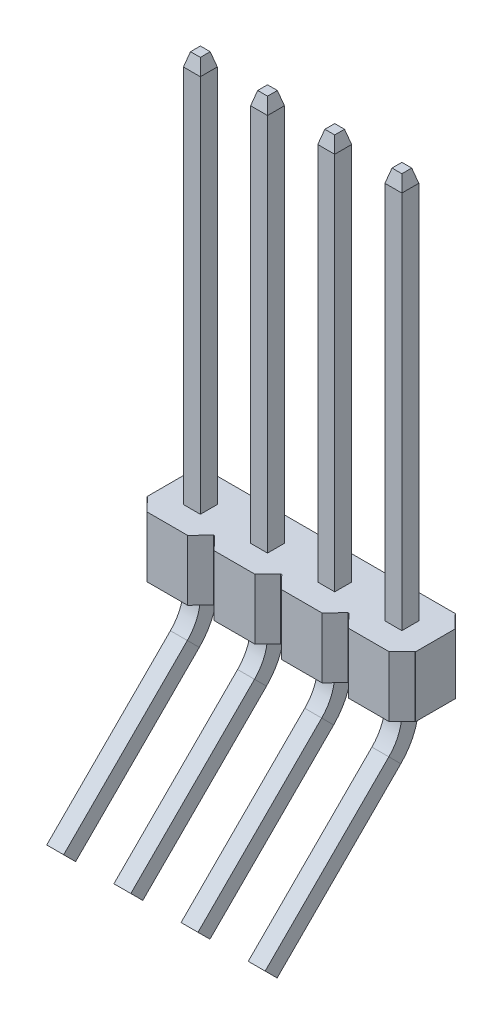
from build123d import *
from OCP.BRepFilletAPI import BRepFilletAPI_MakeChamfer

# Parameters (mm, degrees)
BOSS_EXTRUDE1_DEPTH         = 2.29
SKETCH3_W                   = 0.64
SKETCH3_H                   = 0.64
CHAMFER3_SIZE               = 0.5
CHAMFER3_SIZE2              = 0.133974596
LPATTERN1_COUNT             = 4
LPATTERN1_PITCH             = 2.54
CHAMFER3_OF_LPATTERN1_SIZE  = 0.5
CHAMFER3_OF_LPATTERN1_SIZE2 = 0.133974596


with BuildPart() as part:
    # Sketch1 → Boss-Extrude1 (new body)
    with BuildSketch(Plane(origin=(0, 0, 0), x_dir=(1, 0, 0), z_dir=(0, 1, 0))):
        Polygon((-0.77, 1.25), (0.77, 1.25), (1.25, 0.75), (1.27, 0.75), (1.27, -0.75), (1.25, -0.75), (0.77, -1.25), (-0.77, -1.25), (-1.25, -0.75), (-1.27, -0.75), (-1.27, 0.75), (-1.25, 0.75), align=None)
    boss_extrude1 = extrude(amount=BOSS_EXTRUDE1_DEPTH)

    # Sweep1: sweep along a path in Sketch2
    with BuildLine(Plane(origin=(0, 0, 0), x_dir=(0, 0, -1), z_dir=(1, 0, 0))) as sweep1_path:
        Line((0, 17.12), (0, -0.408142235))
        ThreePointArc((0, -0.408142235), (-0.152240935, -1.1735091), (-0.585786438, -1.822355798))
        Line((-0.585786438, -1.822355798), (-5.26343064, -6.5))
    # Sketch3 → Sweep1 (sweep)
    with BuildSketch(Plane(origin=(0, 17.12, 0), x_dir=(1, 0, 0), z_dir=(0, 1, 0))):
        Rectangle(SKETCH3_W, SKETCH3_H)
    sweep1 = sweep(path=sweep1_path.line)

    # Chamfer3: one chamfer whose edges measure the first distance from different faces: ONE call of the kernel's chamfer builder (chamfer() names one face for all edges)
    chamfer3_edges_1 = [part.edges().sort_by_distance(p)[0] for p in [
        (0.32, 17.12, 0),
    ]]
    chamfer3_side_1 = [part.faces().sort_by_distance(p)[0] for p in [
        (0.32, 9.705, 0),
    ]]
    chamfer3_edges_2 = [part.edges().sort_by_distance(p)[0] for p in [
        (0, 17.12, -0.32),
    ]]
    chamfer3_side_2 = [part.faces().sort_by_distance(p)[0] for p in [
        (0, 9.705, -0.32),
    ]]
    chamfer3_edges_3 = [part.edges().sort_by_distance(p)[0] for p in [
        (-0.32, 17.12, 0),
    ]]
    chamfer3_side_3 = [part.faces().sort_by_distance(p)[0] for p in [
        (-0.32, 9.705, 0),
    ]]
    chamfer3_edges_4 = [part.edges().sort_by_distance(p)[0] for p in [
        (0, 17.12, 0.32),
    ]]
    chamfer3_side_4 = [part.faces().sort_by_distance(p)[0] for p in [
        (0, 9.705, 0.32),
    ]]
    chamfer3 = BRepFilletAPI_MakeChamfer(part.part.solid().wrapped)
    for e in chamfer3_edges_1:
        chamfer3.Add(CHAMFER3_SIZE, CHAMFER3_SIZE2, e.wrapped, chamfer3_side_1[0].wrapped)  # the first distance lies on this face
    for e in chamfer3_edges_2:
        chamfer3.Add(CHAMFER3_SIZE, CHAMFER3_SIZE2, e.wrapped, chamfer3_side_2[0].wrapped)  # the first distance lies on this face
    for e in chamfer3_edges_3:
        chamfer3.Add(CHAMFER3_SIZE, CHAMFER3_SIZE2, e.wrapped, chamfer3_side_3[0].wrapped)  # the first distance lies on this face
    for e in chamfer3_edges_4:
        chamfer3.Add(CHAMFER3_SIZE, CHAMFER3_SIZE2, e.wrapped, chamfer3_side_4[0].wrapped)  # the first distance lies on this face
    add(Compound.cast(chamfer3.Shape()), mode=Mode.REPLACE)

    # LPattern1: Boss-Extrude1, Sweep1 ×4
    with Locations(*[(i * LPATTERN1_PITCH, 0, 0) for i in range(1, LPATTERN1_COUNT)]):
        add(boss_extrude1)
        add(sweep1)

    # Chamfer3 of LPattern1: one chamfer whose edges measure the first distance from different faces: ONE call of the kernel's chamfer builder (chamfer() names one face for all edges)
    chamfer3_of_lpattern1_edges_1 = [part.edges().sort_by_distance(p)[0] for p in [
        (2.86, 17.12, 0),
    ]]
    chamfer3_of_lpattern1_side_1 = [part.faces().sort_by_distance(p)[0] for p in [
        (2.86, 9.705, 0),
    ]]
    chamfer3_of_lpattern1_edges_2 = [part.edges().sort_by_distance(p)[0] for p in [
        (2.54, 17.12, -0.32),
    ]]
    chamfer3_of_lpattern1_side_2 = [part.faces().sort_by_distance(p)[0] for p in [
        (2.54, 9.705, -0.32),
    ]]
    chamfer3_of_lpattern1_edges_3 = [part.edges().sort_by_distance(p)[0] for p in [
        (2.22, 17.12, 0),
    ]]
    chamfer3_of_lpattern1_side_3 = [part.faces().sort_by_distance(p)[0] for p in [
        (2.22, 9.705, 0),
    ]]
    chamfer3_of_lpattern1_edges_4 = [part.edges().sort_by_distance(p)[0] for p in [
        (2.54, 17.12, 0.32),
    ]]
    chamfer3_of_lpattern1_side_4 = [part.faces().sort_by_distance(p)[0] for p in [
        (2.54, 9.705, 0.32),
    ]]
    chamfer3_of_lpattern1_edges_5 = [part.edges().sort_by_distance(p)[0] for p in [
        (5.4, 17.12, 0),
    ]]
    chamfer3_of_lpattern1_side_5 = [part.faces().sort_by_distance(p)[0] for p in [
        (5.4, 9.705, 0),
    ]]
    chamfer3_of_lpattern1_edges_6 = [part.edges().sort_by_distance(p)[0] for p in [
        (5.08, 17.12, -0.32),
    ]]
    chamfer3_of_lpattern1_side_6 = [part.faces().sort_by_distance(p)[0] for p in [
        (5.08, 9.705, -0.32),
    ]]
    chamfer3_of_lpattern1_edges_7 = [part.edges().sort_by_distance(p)[0] for p in [
        (4.76, 17.12, 0),
    ]]
    chamfer3_of_lpattern1_side_7 = [part.faces().sort_by_distance(p)[0] for p in [
        (4.76, 9.705, 0),
    ]]
    chamfer3_of_lpattern1_edges_8 = [part.edges().sort_by_distance(p)[0] for p in [
        (5.08, 17.12, 0.32),
    ]]
    chamfer3_of_lpattern1_side_8 = [part.faces().sort_by_distance(p)[0] for p in [
        (5.08, 9.705, 0.32),
    ]]
    chamfer3_of_lpattern1_edges_9 = [part.edges().sort_by_distance(p)[0] for p in [
        (7.94, 17.12, 0),
    ]]
    chamfer3_of_lpattern1_side_9 = [part.faces().sort_by_distance(p)[0] for p in [
        (7.94, 9.705, 0),
    ]]
    chamfer3_of_lpattern1_edges_10 = [part.edges().sort_by_distance(p)[0] for p in [
        (7.62, 17.12, -0.32),
    ]]
    chamfer3_of_lpattern1_side_10 = [part.faces().sort_by_distance(p)[0] for p in [
        (7.62, 9.705, -0.32),
    ]]
    chamfer3_of_lpattern1_edges_11 = [part.edges().sort_by_distance(p)[0] for p in [
        (7.3, 17.12, 0),
    ]]
    chamfer3_of_lpattern1_side_11 = [part.faces().sort_by_distance(p)[0] for p in [
        (7.3, 9.705, 0),
    ]]
    chamfer3_of_lpattern1_edges_12 = [part.edges().sort_by_distance(p)[0] for p in [
        (7.62, 17.12, 0.32),
    ]]
    chamfer3_of_lpattern1_side_12 = [part.faces().sort_by_distance(p)[0] for p in [
        (7.62, 9.705, 0.32),
    ]]
    chamfer3_of_lpattern1 = BRepFilletAPI_MakeChamfer(part.part.solid().wrapped)
    for e in chamfer3_of_lpattern1_edges_1:
        chamfer3_of_lpattern1.Add(CHAMFER3_OF_LPATTERN1_SIZE, CHAMFER3_OF_LPATTERN1_SIZE2, e.wrapped, chamfer3_of_lpattern1_side_1[0].wrapped)  # the first distance lies on this face
    for e in chamfer3_of_lpattern1_edges_2:
        chamfer3_of_lpattern1.Add(CHAMFER3_OF_LPATTERN1_SIZE, CHAMFER3_OF_LPATTERN1_SIZE2, e.wrapped, chamfer3_of_lpattern1_side_2[0].wrapped)  # the first distance lies on this face
    for e in chamfer3_of_lpattern1_edges_3:
        chamfer3_of_lpattern1.Add(CHAMFER3_OF_LPATTERN1_SIZE, CHAMFER3_OF_LPATTERN1_SIZE2, e.wrapped, chamfer3_of_lpattern1_side_3[0].wrapped)  # the first distance lies on this face
    for e in chamfer3_of_lpattern1_edges_4:
        chamfer3_of_lpattern1.Add(CHAMFER3_OF_LPATTERN1_SIZE, CHAMFER3_OF_LPATTERN1_SIZE2, e.wrapped, chamfer3_of_lpattern1_side_4[0].wrapped)  # the first distance lies on this face
    for e in chamfer3_of_lpattern1_edges_5:
        chamfer3_of_lpattern1.Add(CHAMFER3_OF_LPATTERN1_SIZE, CHAMFER3_OF_LPATTERN1_SIZE2, e.wrapped, chamfer3_of_lpattern1_side_5[0].wrapped)  # the first distance lies on this face
    for e in chamfer3_of_lpattern1_edges_6:
        chamfer3_of_lpattern1.Add(CHAMFER3_OF_LPATTERN1_SIZE, CHAMFER3_OF_LPATTERN1_SIZE2, e.wrapped, chamfer3_of_lpattern1_side_6[0].wrapped)  # the first distance lies on this face
    for e in chamfer3_of_lpattern1_edges_7:
        chamfer3_of_lpattern1.Add(CHAMFER3_OF_LPATTERN1_SIZE, CHAMFER3_OF_LPATTERN1_SIZE2, e.wrapped, chamfer3_of_lpattern1_side_7[0].wrapped)  # the first distance lies on this face
    for e in chamfer3_of_lpattern1_edges_8:
        chamfer3_of_lpattern1.Add(CHAMFER3_OF_LPATTERN1_SIZE, CHAMFER3_OF_LPATTERN1_SIZE2, e.wrapped, chamfer3_of_lpattern1_side_8[0].wrapped)  # the first distance lies on this face
    for e in chamfer3_of_lpattern1_edges_9:
        chamfer3_of_lpattern1.Add(CHAMFER3_OF_LPATTERN1_SIZE, CHAMFER3_OF_LPATTERN1_SIZE2, e.wrapped, chamfer3_of_lpattern1_side_9[0].wrapped)  # the first distance lies on this face
    for e in chamfer3_of_lpattern1_edges_10:
        chamfer3_of_lpattern1.Add(CHAMFER3_OF_LPATTERN1_SIZE, CHAMFER3_OF_LPATTERN1_SIZE2, e.wrapped, chamfer3_of_lpattern1_side_10[0].wrapped)  # the first distance lies on this face
    for e in chamfer3_of_lpattern1_edges_11:
        chamfer3_of_lpattern1.Add(CHAMFER3_OF_LPATTERN1_SIZE, CHAMFER3_OF_LPATTERN1_SIZE2, e.wrapped, chamfer3_of_lpattern1_side_11[0].wrapped)  # the first distance lies on this face
    for e in chamfer3_of_lpattern1_edges_12:
        chamfer3_of_lpattern1.Add(CHAMFER3_OF_LPATTERN1_SIZE, CHAMFER3_OF_LPATTERN1_SIZE2, e.wrapped, chamfer3_of_lpattern1_side_12[0].wrapped)  # the first distance lies on this face
    add(Compound.cast(chamfer3_of_lpattern1.Shape()), mode=Mode.REPLACE)


solid = part.part
